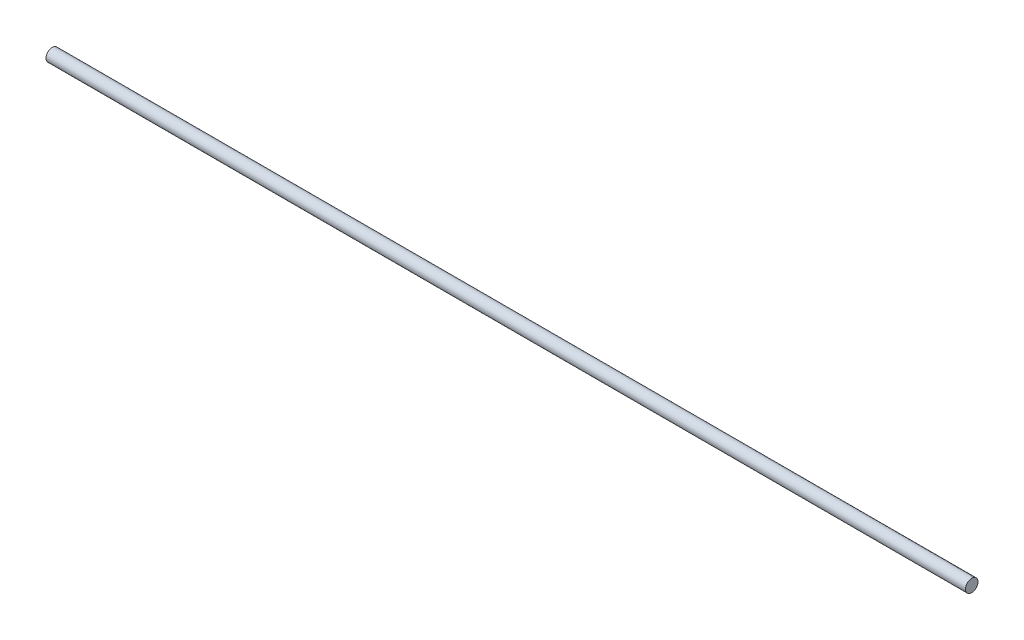
from build123d import *

# Parameters (mm, degrees)
SWEEP1_PROFILE_R = 4.7625


with BuildPart() as part:
    # Sweep1: sweep along a path in Sketch1
    with BuildLine(Plane(origin=(0, 0, 0), x_dir=(1, 0, 0), z_dir=(0, 1, 0))) as sweep1_path:
        Line((-350, 0), (350, 0))
    # Sweep1 profile (on start of the path) → Sweep1 (sweep)
    with BuildSketch(Plane(origin=(-350, 0, 0), x_dir=(0, 0, 1), z_dir=(1, 0, 0))):
        Circle(SWEEP1_PROFILE_R)
    sweep(path=sweep1_path.line)


solid = part.part
